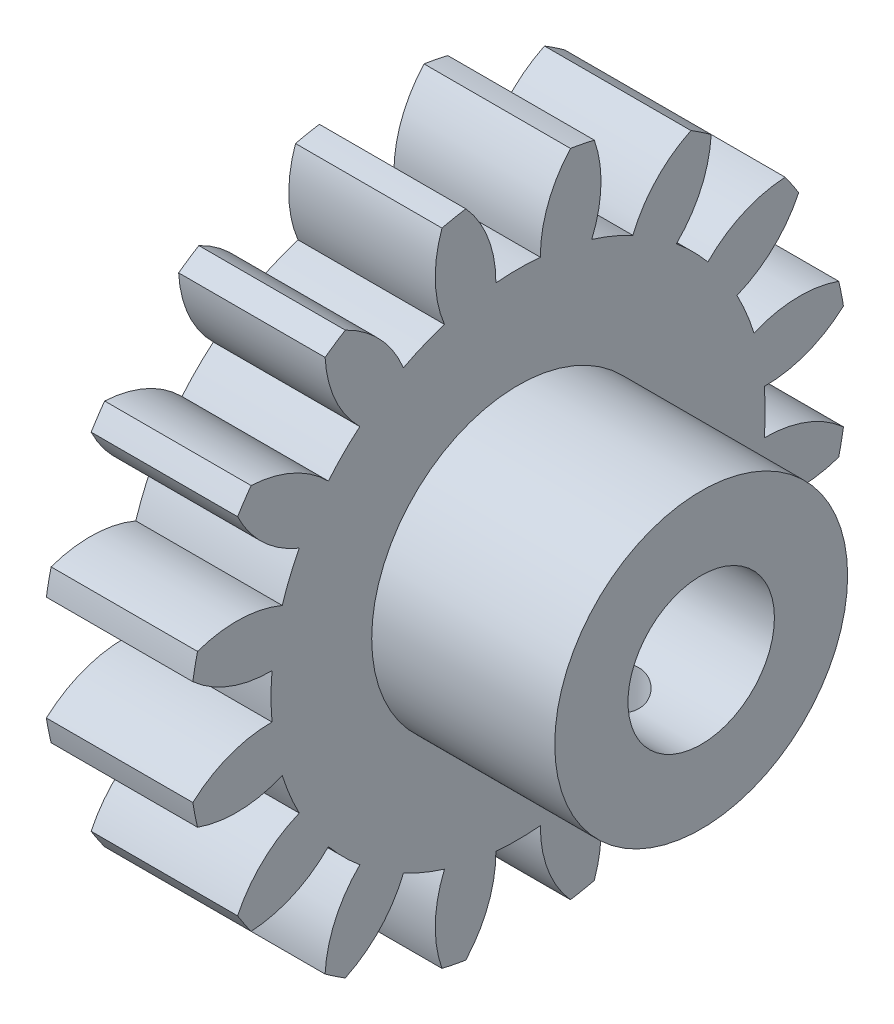
from build123d import *

# Parameters (mm, degrees)
BASPROSKE_W             = 10
BASPROSKE_H             = 22.5
TOOTHCUT_DEPTH          = 34.35416016
TEETHCUTS_COUNT         = 16
TEETHCUTS_ANGLE         = 337.5
BORSKE_R                = 5
BORE_DEPTH              = 50.0000508
BOSS_EXTRU_1_START      = 12.5
ESQUISSE1_R             = 10
ESQUISSE1_R_2           = 5
BOSS_EXTRU_1_DEPTH      = 12.5
ESQUISSE2_R             = 2
ENL_V_MAT_EXTRU_1_DEPTH = 12.5


with BuildPart() as part:
    # BasProSke → Base-Revolve (revolve)
    with BuildSketch(Plane(origin=(0, 0, 0), x_dir=(1, 0, 0), z_dir=(0, 1, 0)), mode=Mode.PRIVATE) as base_revolve_sk:
        with Locations((5, 11.25)):
            Rectangle(BASPROSKE_W, BASPROSKE_H)
    revolve(base_revolve_sk.sketch.rotate(Axis((-10, 0, 0), (1, 0, 0)), 180), axis=Axis((-10, 0, 0), (1, 0, 0)))

    # TooCutSke → ToothCut (cut, through all)
    with BuildSketch(Plane(origin=(0, 0, 0), x_dir=(0, 0, -1), z_dir=(1, 0, 0))):
        with BuildLine():
            ThreePointArc((1.518290096, 16.805554772), (0, 16.874), (-1.518290096, 16.805554772))
            ThreePointArc((-1.518290096, 16.805554772), (-2.044619878, 19.716421455), (-3.592732808, 22.237039284))
            ThreePointArc((-3.592732808, 22.237039284), (0, 22.5254), (3.592732808, 22.237039284))
            ThreePointArc((3.592732808, 22.237039284), (2.044619878, 19.716421455), (1.518290096, 16.805554772))
        make_face()
    toothcut = extrude(amount=TOOTHCUT_DEPTH, mode=Mode.SUBTRACT)

    # TeethCuts: ToothCut ×16 about axis
    teethcuts_axis = Axis((-10, 0, 0), (1, 0, 0))
    for i in range(1, TEETHCUTS_COUNT):
        add(toothcut.rotate(teethcuts_axis, i * TEETHCUTS_ANGLE / (TEETHCUTS_COUNT - 1)), mode=Mode.SUBTRACT)

    # BorSke → Bore (cut, symmetric)
    with BuildSketch(Plane(origin=(0, 0, 0), x_dir=(0, 0, -1), z_dir=(1, 0, 0))):
        with Locations(Location((0, 0, 0), (0, 0, 180))):
            Circle(BORSKE_R)
    extrude(amount=BORE_DEPTH, both=True, mode=Mode.SUBTRACT)

    # Esquisse1 → Boss.-Extru.1 (add)
    with BuildSketch(Plane(origin=(10, 0, 0), x_dir=(0, 0, -1), z_dir=(1, 0, 0)).offset(BOSS_EXTRU_1_START)):
        with Locations(Location((0, 0, 0), (0, 0, 180))):
            Circle(ESQUISSE1_R)
        Circle(ESQUISSE1_R_2, mode=Mode.SUBTRACT)
    extrude(amount=-BOSS_EXTRU_1_DEPTH)

    # Esquisse2 → Enlèv. mat.-Extru.1 (cut)
    with BuildSketch(Plane(origin=(0, 0, 0), x_dir=(1, 0, 0), z_dir=(0, 1, 0))):
        with Locations(Location((16.25, 0, 0), (0, 0, 270))):
            Circle(ESQUISSE2_R)
    extrude(amount=-ENL_V_MAT_EXTRU_1_DEPTH, mode=Mode.SUBTRACT)


solid = part.part
